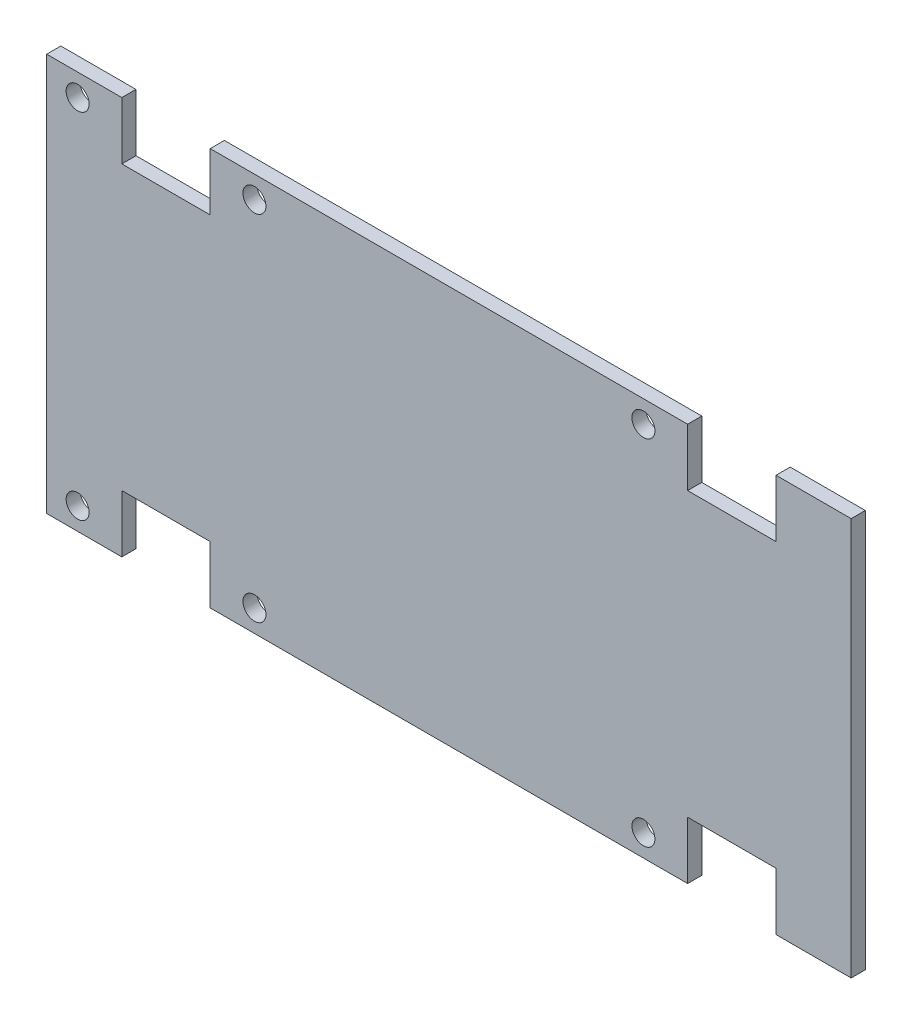
from build123d import *

# Parameters (mm, degrees)
SKETCH_1_W          = 91
SKETCH_1_H          = 45
EXTRUDE_1_DEPTH     = 1.6
SKETCH_2_R          = 1.3
CUT_EXTRUDE_1_DEPTH = 1.6
SKETCH_5_W          = 10
SKETCH_5_H          = 6.5
CUT_EXTRUDE_2_DEPTH = 1.6


with BuildPart() as part:
    # Эскиз1 → Бобышка-Вытянуть1 (new body)
    with BuildSketch(Plane.XY):
        Rectangle(SKETCH_1_W, SKETCH_1_H)
    extrude(amount=EXTRUDE_1_DEPTH)

    # Эскиз2 → Вырез-Вытянуть1 (cut)
    with BuildSketch(Plane(origin=(0, 0, 0), x_dir=(-1, 0, 0), z_dir=(0, 0, -1))):
        with Locations((22, 20)):
            Circle(SKETCH_2_R)
        with Locations((-22, 20)):
            Circle(SKETCH_2_R)
        with Locations((42, 20)):
            Circle(SKETCH_2_R)
        with Locations((42, -20)):
            Circle(SKETCH_2_R)
        with Locations((22, -20)):
            Circle(SKETCH_2_R)
        with Locations((-22, -20)):
            Circle(SKETCH_2_R)
    extrude(amount=-CUT_EXTRUDE_1_DEPTH, mode=Mode.SUBTRACT)

    # Эскиз5 → Вырез-Вытянуть2 (cut)
    with BuildSketch(Plane(origin=(0, 0, 0), x_dir=(-1, 0, 0), z_dir=(0, 0, -1))):
        with Locations((-32, 19.25)):
            Rectangle(SKETCH_5_W, SKETCH_5_H)
        with Locations((32, 19.25)):
            Rectangle(SKETCH_5_W, SKETCH_5_H)
        with Locations((32, -19.25)):
            Rectangle(SKETCH_5_W, SKETCH_5_H)
        with Locations((-32, -19.25)):
            Rectangle(SKETCH_5_W, SKETCH_5_H)
    extrude(amount=-CUT_EXTRUDE_2_DEPTH, mode=Mode.SUBTRACT)


solid = part.part
